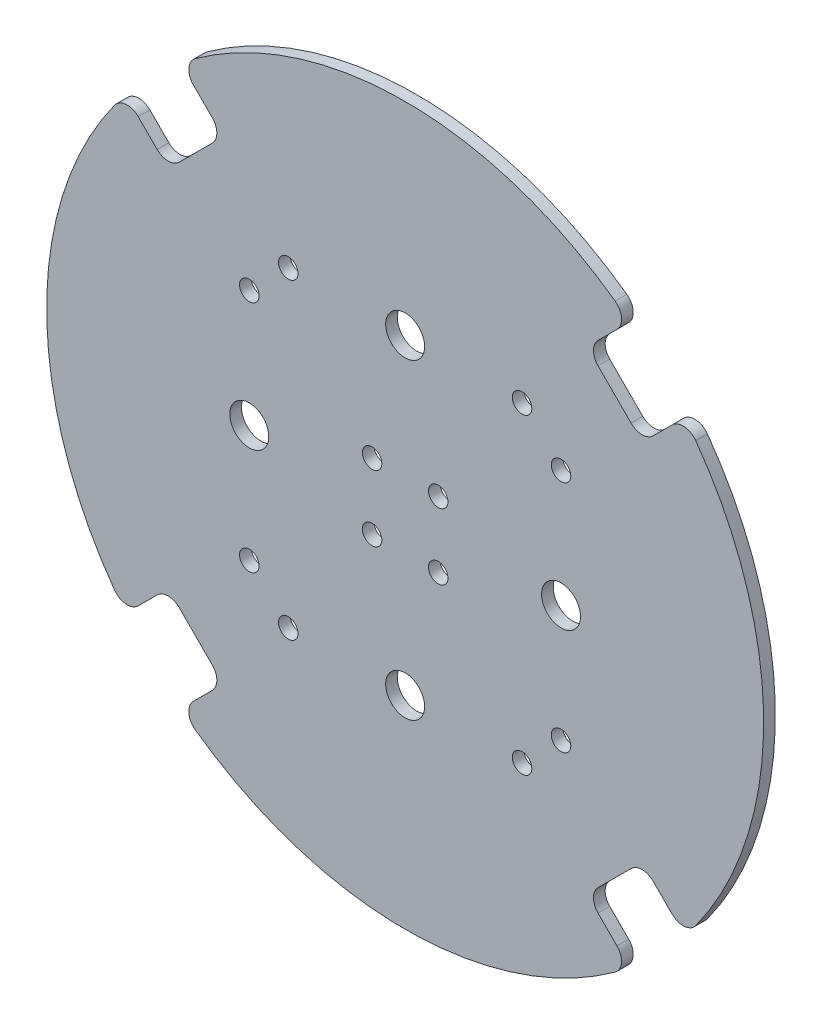
from build123d import *

# Parameters (mm, degrees)
SKETCH5_R           = 2.5
SKETCH5_R_2         = 1.25
BOSS_EXTRUDE1_DEPTH = 1.5


with BuildPart() as part:
    # Sketch5 → Boss-Extrude1 (new body)
    with BuildSketch(Plane.XY):
        with BuildLine():
            Line((-34.251979013, 27.180911201), (-31.819805153, 24.748737342))
            ThreePointArc((-31.819805153, 24.748737342), (-30.405591591, 24.162950904), (-28.991378029, 24.748737342))
            Line((-28.991378029, 24.748737342), (-24.748737342, 28.991378029))
            ThreePointArc((-24.748737342, 28.991378029), (-24.162950904, 30.405591591), (-24.748737342, 31.819805153))
            Line((-24.748737342, 31.819805153), (-27.180911201, 34.251979013))
            ThreePointArc((-27.180911201, 34.251979013), (-27.760319437, 35.825792464), (-26.937911168, 37.287383147))
            ThreePointArc((-26.937911168, 37.287383147), (0, 46), (26.937911168, 37.287383147))
            ThreePointArc((26.937911168, 37.287383147), (27.760319437, 35.825792464), (27.180911201, 34.251979013))
            Line((27.180911201, 34.251979013), (24.748737342, 31.819805153))
            ThreePointArc((24.748737342, 31.819805153), (24.162950904, 30.405591591), (24.748737342, 28.991378029))
            Line((24.748737342, 28.991378029), (28.991378029, 24.748737342))
            ThreePointArc((28.991378029, 24.748737342), (30.405591591, 24.162950904), (31.819805153, 24.748737342))
            Line((31.819805153, 24.748737342), (34.251979013, 27.180911201))
            ThreePointArc((34.251979013, 27.180911201), (35.825792464, 27.760319437), (37.287383147, 26.937911168))
            ThreePointArc((37.287383147, 26.937911168), (46, 0), (37.287383147, -26.937911168))
            ThreePointArc((37.287383147, -26.937911168), (35.825792464, -27.760319437), (34.251979013, -27.180911201))
            Line((34.251979013, -27.180911201), (31.819805153, -24.748737342))
            ThreePointArc((31.819805153, -24.748737342), (30.405591591, -24.162950904), (28.991378029, -24.748737342))
            Line((28.991378029, -24.748737342), (24.748737342, -28.991378029))
            ThreePointArc((24.748737342, -28.991378029), (24.162950904, -30.405591591), (24.748737342, -31.819805153))
            Line((24.748737342, -31.819805153), (27.180911201, -34.251979013))
            ThreePointArc((27.180911201, -34.251979013), (27.760319437, -35.825792464), (26.937911168, -37.287383147))
            ThreePointArc((26.937911168, -37.287383147), (0, -46), (-26.937911168, -37.287383147))
            ThreePointArc((-26.937911168, -37.287383147), (-27.760319437, -35.825792464), (-27.180911201, -34.251979013))
            Line((-27.180911201, -34.251979013), (-24.748737342, -31.819805153))
            ThreePointArc((-24.748737342, -31.819805153), (-24.162950904, -30.405591591), (-24.748737342, -28.991378029))
            Line((-24.748737342, -28.991378029), (-28.991378029, -24.748737342))
            ThreePointArc((-28.991378029, -24.748737342), (-30.405591591, -24.162950904), (-31.819805153, -24.748737342))
            Line((-31.819805153, -24.748737342), (-34.251979013, -27.180911201))
            ThreePointArc((-34.251979013, -27.180911201), (-35.825792464, -27.760319437), (-37.287383147, -26.937911168))
            ThreePointArc((-37.287383147, -26.937911168), (-46, 0), (-37.287383147, 26.937911168))
            ThreePointArc((-37.287383147, 26.937911168), (-35.825792464, 27.760319437), (-34.251979013, 27.180911201))
        make_face()
        with Locations((-20, 0)):
            Circle(SKETCH5_R, mode=Mode.SUBTRACT)
        with Locations((-20, 15)):
            Circle(SKETCH5_R_2, mode=Mode.SUBTRACT)
        with Locations((-20, -15)):
            Circle(SKETCH5_R_2, mode=Mode.SUBTRACT)
        with Locations((-15, -20)):
            Circle(SKETCH5_R_2, mode=Mode.SUBTRACT)
        with Locations((0, -20)):
            Circle(SKETCH5_R, mode=Mode.SUBTRACT)
        with Locations((15, -20)):
            Circle(SKETCH5_R_2, mode=Mode.SUBTRACT)
        with Locations((20, -15)):
            Circle(SKETCH5_R_2, mode=Mode.SUBTRACT)
        with Locations((20, 0)):
            Circle(SKETCH5_R, mode=Mode.SUBTRACT)
        with Locations((20, 15)):
            Circle(SKETCH5_R_2, mode=Mode.SUBTRACT)
        with Locations((15, 20)):
            Circle(SKETCH5_R_2, mode=Mode.SUBTRACT)
        with Locations((0, 20)):
            Circle(SKETCH5_R, mode=Mode.SUBTRACT)
        with Locations((-15, 20)):
            Circle(SKETCH5_R_2, mode=Mode.SUBTRACT)
        with Locations((4.242640687, 4.242640687)):
            Circle(SKETCH5_R_2, mode=Mode.SUBTRACT)
        with Locations((-4.242640687, 4.242640687)):
            Circle(SKETCH5_R_2, mode=Mode.SUBTRACT)
        with Locations((-4.242640687, -4.242640687)):
            Circle(SKETCH5_R_2, mode=Mode.SUBTRACT)
        with Locations((4.242640687, -4.242640687)):
            Circle(SKETCH5_R_2, mode=Mode.SUBTRACT)
    extrude(amount=BOSS_EXTRUDE1_DEPTH)


solid = part.part
